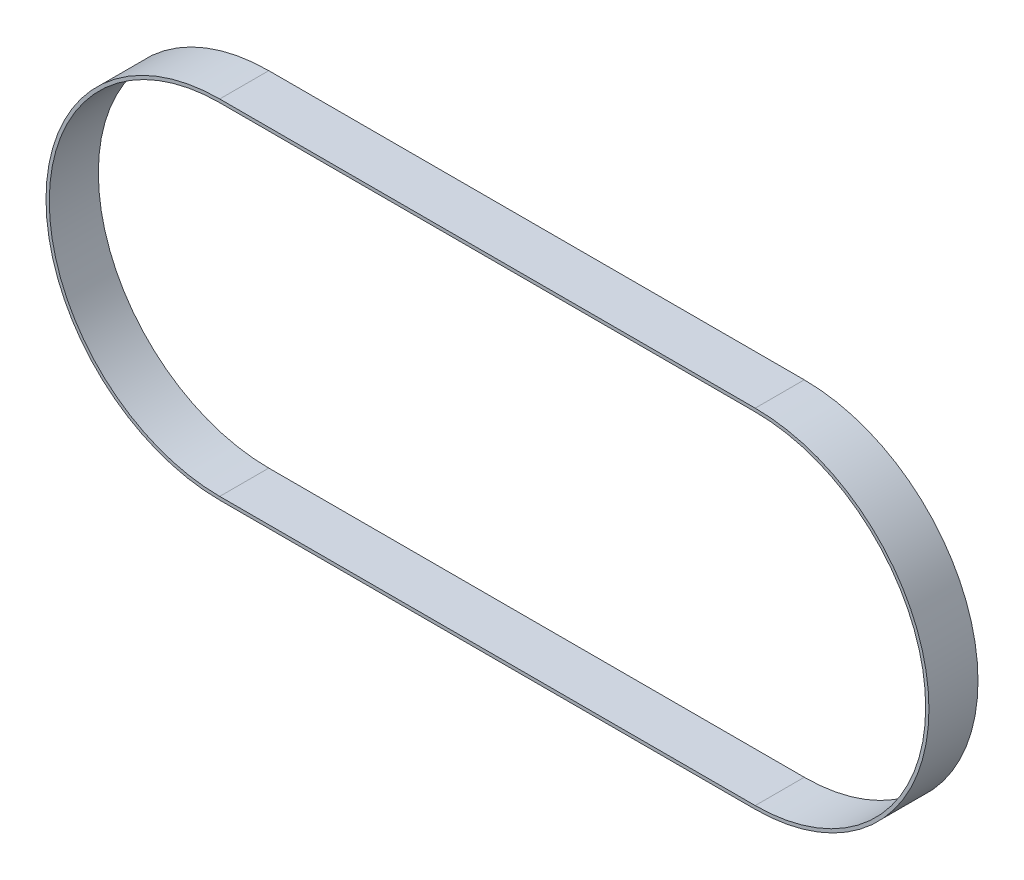
from build123d import *

# Parameters (mm, degrees)
BOSS_EXTRUDE1_DEPTH = 15


with BuildPart() as part:
    # Sketch1 → Boss-Extrude1 (new body)
    with BuildSketch(Plane.XY):
        with BuildLine():
            Line((-81.875, 53.123243863), (81.875, 53.123243863))
            ThreePointArc((81.875, 53.123243863), (134.998243863, 0), (81.875, -53.123243863))
            Line((81.875, -53.123243863), (-81.875, -53.123243863))
            ThreePointArc((-81.875, -53.123243863), (-134.998243863, 0), (-81.875, 53.123243863))
        make_face()
        with BuildLine():
            Line((-81.875, 52.123243863), (81.875, 52.123243863))
            ThreePointArc((81.875, 52.123243863), (133.998243863, 0), (81.875, -52.123243863))
            Line((81.875, -52.123243863), (-81.875, -52.123243863))
            ThreePointArc((-81.875, -52.123243863), (-133.998243863, 0), (-81.875, 52.123243863))
        make_face(mode=Mode.SUBTRACT)
    extrude(amount=BOSS_EXTRUDE1_DEPTH)


solid = part.part
